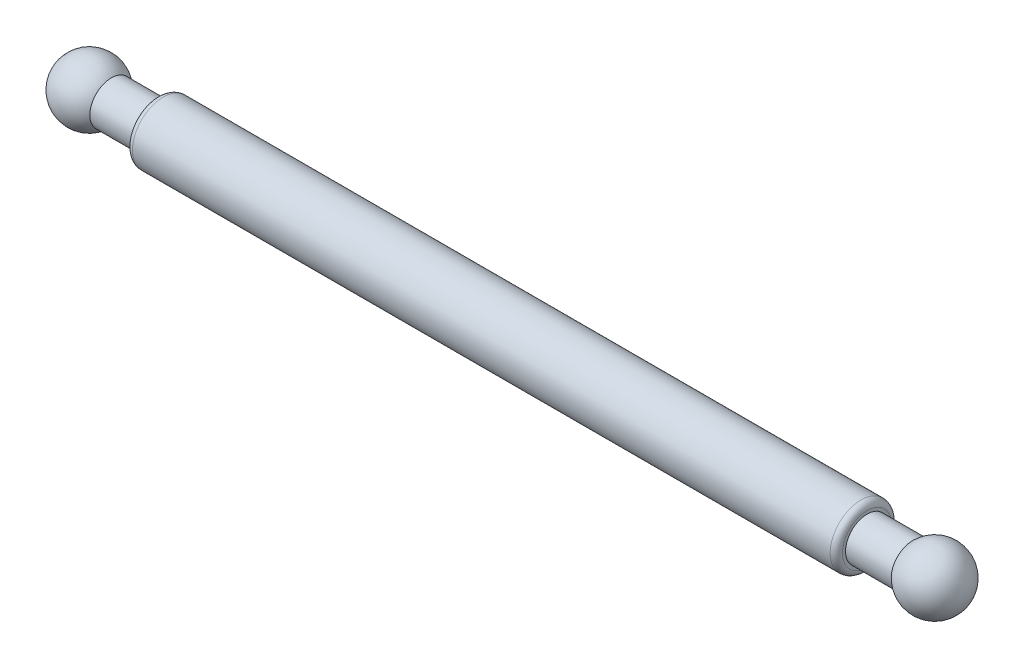
from build123d import *

# Parameters (mm, degrees)
SKETCH2_R           = 3.5
BOSS_EXTRUDE1_DEPTH = 68.75
SKETCH3_R           = 5
BOSS_EXTRUDE2_DEPTH = 57.75
FILLET1_R           = 1


with BuildPart() as part:
    # Sketch1 → Revolve1 (revolve)
    with BuildSketch(Plane(origin=(0, 0, 0), x_dir=(1, 0, 0), z_dir=(0, 1, 0))):
        with BuildLine():
            Line((0, 5), (0, -5))
            ThreePointArc((0, -5), (5, 0), (0, 5))
        make_face()
    revolve(axis=Axis((0, 0, -5), (0, 0, 1)))

    # Sketch2 → Boss-Extrude1 (add)
    with BuildSketch(Plane(origin=(0, 0, 0), x_dir=(0, 0, -1), z_dir=(1, 0, 0))):
        with Locations(Location((0, 0, 0), (0, 0, 180))):
            Circle(SKETCH2_R)
    extrude(amount=BOSS_EXTRUDE1_DEPTH)

    # Sketch3 → Boss-Extrude2 (add)
    with BuildSketch(Plane(origin=(68.75, 0, 0), x_dir=(0, 0, -1), z_dir=(1, 0, 0))):
        Circle(SKETCH3_R)
    extrude(amount=-BOSS_EXTRUDE2_DEPTH)

    # Fillet1
    fillet1_edges = [part.edges().sort_by_distance(p)[0] for p in [
        (11, 0, 5),
    ]]
    fillet(fillet1_edges, radius=FILLET1_R)

    # Mirror1: part across face


with BuildPart() as part_1:
    add(part.part)
    add(part.part.mirror(Plane(origin=(68.75, 0, 0), x_dir=(0, 0, 1), z_dir=(1, 0, 0))))


solid = part_1.part
